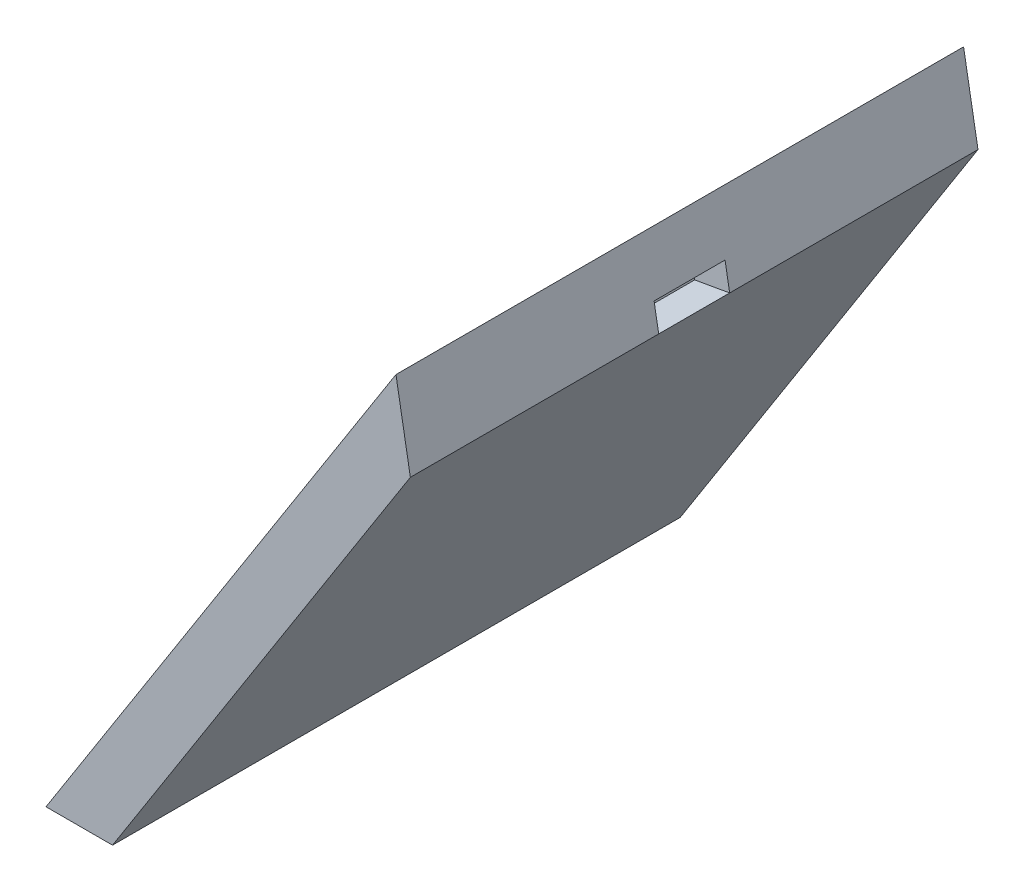
from build123d import *

# Parameters (mm, degrees)
BOSS_EXTRUDE1_DEPTH = 64
CUT_EXTRUDE1_DEPTH  = 4


with BuildPart() as part:
    # Sketch1 → Boss-Extrude1 (new body)
    with BuildSketch(Plane.XY):
        Polygon((0, 0), (7.5, 0), (41.081225522, 52.711965363), (39.456184018, 61.933802982), align=None)
    extrude(amount=BOSS_EXTRUDE1_DEPTH)

    # Sketch2 → Cut-Extrude1 (cut)
    with BuildSketch(Plane(origin=(48.852955135, 8.608705004, 0), x_dir=(0, 0, -1), z_dir=(0.9848263256181995, 0.1735428142256437, 0))):
        Polygon((-32, 44.782779676), (-28, 44.782779676), (-28, 47.782779676), (-36, 47.782779676), (-36, 44.782779676), align=None)
    extrude(amount=-CUT_EXTRUDE1_DEPTH, mode=Mode.SUBTRACT)


solid = part.part
